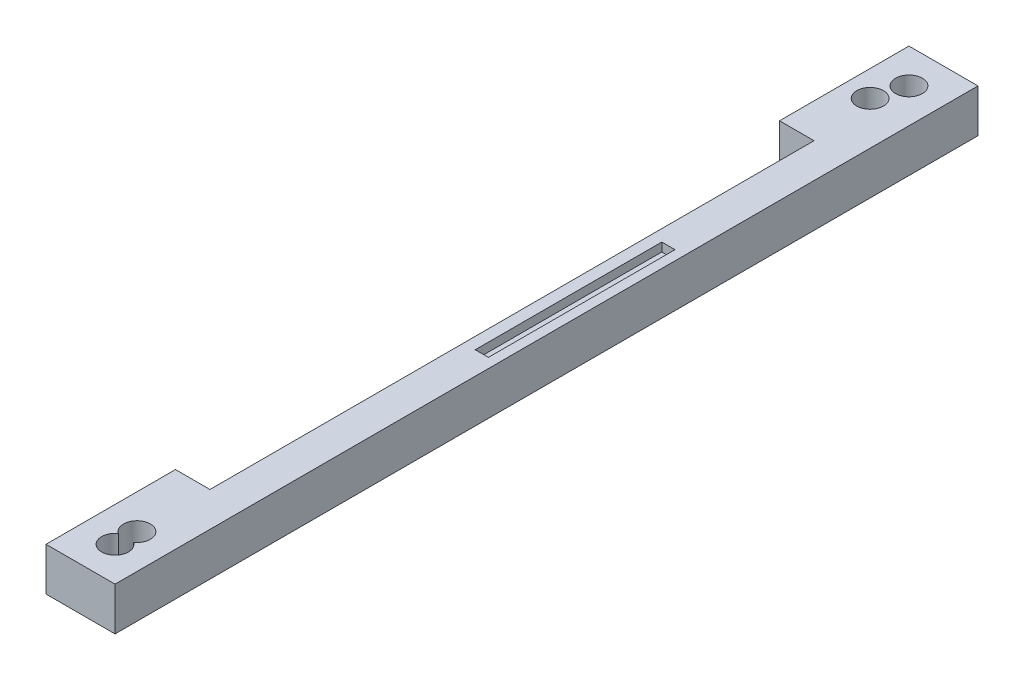
from build123d import *

# Parameters (mm, degrees)
SKETCH1_W      = 8
SKETCH1_H      = 100
EXTRUDE1_DEPTH = 5
SKETCH2_R      = 1.55
EXTRUDE4_DEPTH = 5
SKETCH4_R      = 1.55
EXTRUDE6_DEPTH = 5
SKETCH5_W      = 4
SKETCH5_H      = 70
EXTRUDE7_DEPTH = 5
SKETCH6_W      = 1.530516358
SKETCH6_H      = 21.618543552
EXTRUDE8_DEPTH = 1


with BuildPart() as part:
    # Sketch1 → Extrude1 (new body)
    with BuildSketch(Plane(origin=(0, 0, 0), x_dir=(1, 0, 0), z_dir=(0, 1, 0))):
        Rectangle(SKETCH1_W, SKETCH1_H)
    extrude(amount=EXTRUDE1_DEPTH)

    # Sketch2 → Extrude4 (cut)
    with BuildSketch(Plane(origin=(0, 5, 0), x_dir=(1, 0, 0), z_dir=(0, 1, 0))):
        with Locations(Location((0, -46, 0), (0, 0, 270))):
            Circle(SKETCH2_R)
    extrude(amount=-EXTRUDE4_DEPTH, mode=Mode.SUBTRACT)

    # Sketch4 → Extrude6 (cut)
    with BuildSketch(Plane(origin=(0, 5, 0), x_dir=(1, 0, 0), z_dir=(0, 1, 0))):
        with Locations((0, -43.46)):
            Circle(SKETCH4_R)
        with Locations((0, -46)):
            Circle(SKETCH4_R)
        with Locations(Location((-1, 42.5, 0), (0, 0, 270))):
            Circle(SKETCH4_R)
        with Locations(Location((0, 46, 0), (0, 0, 270))):
            Circle(SKETCH4_R)
    extrude(amount=-EXTRUDE6_DEPTH, mode=Mode.SUBTRACT)

    # Sketch5 → Extrude7 (cut)
    with BuildSketch(Plane(origin=(0, 5, 0), x_dir=(1, 0, 0), z_dir=(0, 1, 0))):
        with Locations((-2, 0)):
            Rectangle(SKETCH5_W, SKETCH5_H)
    extrude(amount=-EXTRUDE7_DEPTH, mode=Mode.SUBTRACT)

    # Sketch6 → Extrude8 (cut)
    with BuildSketch(Plane(origin=(0, 5, 0), x_dir=(1, 0, 0), z_dir=(0, 1, 0))):
        with Locations((2.112618746, 5.201364346)):
            Rectangle(SKETCH6_W, SKETCH6_H)
    extrude(amount=-EXTRUDE8_DEPTH, mode=Mode.SUBTRACT)


solid = part.part
